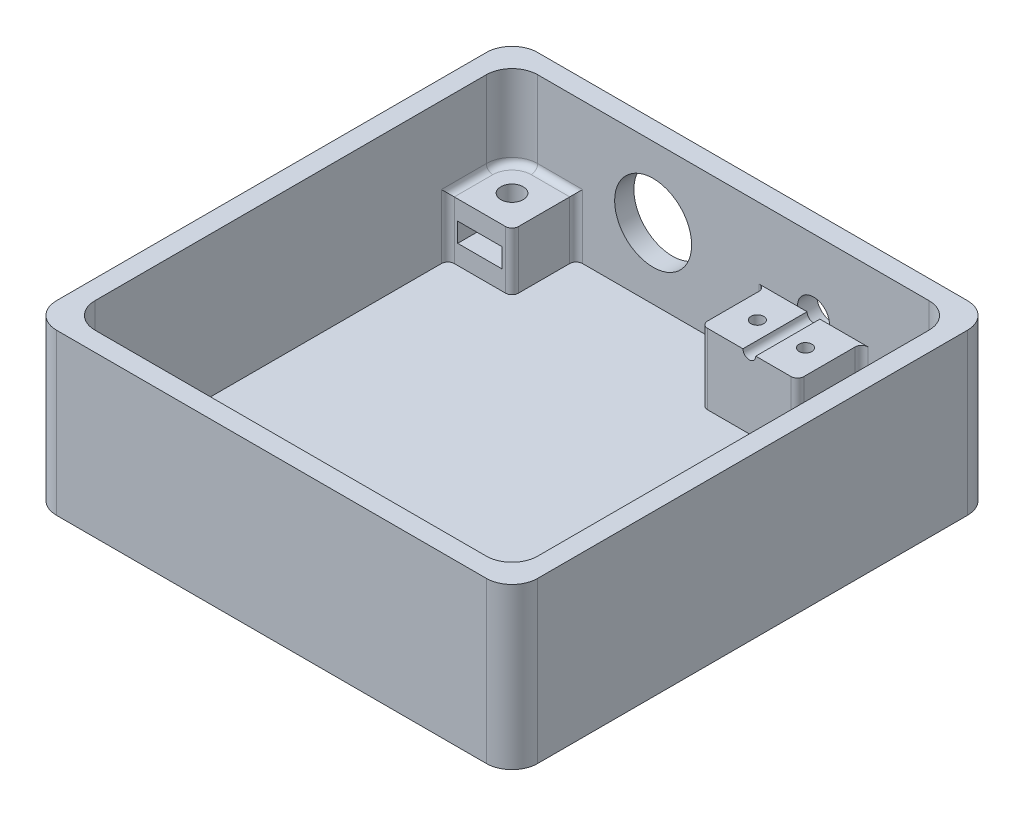
from build123d import *

# Parameters (mm, degrees)
SKETCH_1_W          = 75
SKETCH_1_H          = 75
EXTRUDE_1_DEPTH     = 25
SHELL_1_T           = -3
SKETCH_3_W          = 10
SKETCH_3_H          = 10
EXTRUDE_2_DEPTH     = 9
CUT_EXTRUDE_1_REACH = 56.603
SKETCH_4_R          = 1.75
CUT_EXTRUDE_START   = -3
CUT_EXTRUDE_2_DEPTH = 3
CUT_EXTRUDE_3_REACH = 89.5
SKETCH_6_R          = 6
SKETCH_6_R_2        = 2.5
EXTRUDE_3_DEPTH     = 10
SKETCH_8_R          = 1
CUT_EXTRUDE_4_DEPTH = 4
FILLET_1_R          = 4
FILLET_2_R          = 1


with BuildPart() as part:
    # 草图1 → 凸台-拉伸1 (new body)
    with BuildSketch(Plane(origin=(0, 0, 0), x_dir=(1, 0, 0), z_dir=(0, 1, 0))):
        Rectangle(SKETCH_1_W, SKETCH_1_H)
    extrude(amount=EXTRUDE_1_DEPTH)

    # 抽壳1
    shell_1_openings = [part.faces().sort_by_distance(p)[0] for p in [
        (0, 25, 0),
    ]]
    offset(amount=SHELL_1_T, openings=shell_1_openings, kind=Kind.INTERSECTION)

    # 草图3 → 凸台-拉伸2 (add)
    with BuildSketch(Plane(origin=(0, 3, 0), x_dir=(1, 0, 0), z_dir=(0, 1, 0))):
        with Locations((-29.5, -29.5)):
            Rectangle(SKETCH_3_W, SKETCH_3_H)
        with Locations((29.5, -29.5)):
            Rectangle(SKETCH_3_W, SKETCH_3_H)
        with Locations((29.5, 29.5)):
            Rectangle(SKETCH_3_W, SKETCH_3_H)
        with Locations((-29.5, 29.5)):
            Rectangle(SKETCH_3_W, SKETCH_3_H)
    extrude(amount=EXTRUDE_2_DEPTH)

    # 草图4 → 切除-拉伸1 (cut, up to next)
    with BuildSketch(Plane(origin=(0, 12, 0), x_dir=(1, 0, 0), z_dir=(0, 1, 0)), mode=Mode.PRIVATE) as cut_extrude_1_sk1:
        with Locations(Location((-29.5, 29.5, 0), (0, 0, 270))):
            Circle(SKETCH_4_R)
    cut_extrude_1_tool1 = extrude(cut_extrude_1_sk1.sketch, amount=-CUT_EXTRUDE_1_REACH, mode=Mode.PRIVATE) & part.part
    # 草图4 → 切除-拉伸1 (cut, up to next)
    with BuildSketch(Plane(origin=(0, 12, 0), x_dir=(1, 0, 0), z_dir=(0, 1, 0)), mode=Mode.PRIVATE) as cut_extrude_1_sk2:
        with Locations(Location((29.5, 29.5, 0), (0, 0, 270))):
            Circle(SKETCH_4_R)
    cut_extrude_1_tool2 = extrude(cut_extrude_1_sk2.sketch, amount=-CUT_EXTRUDE_1_REACH, mode=Mode.PRIVATE) & part.part
    # 草图4 → 切除-拉伸1 (cut, up to next)
    with BuildSketch(Plane(origin=(0, 12, 0), x_dir=(1, 0, 0), z_dir=(0, 1, 0)), mode=Mode.PRIVATE) as cut_extrude_1_sk3:
        with Locations(Location((29.5, -29.5, 0), (0, 0, 270))):
            Circle(SKETCH_4_R)
    cut_extrude_1_tool3 = extrude(cut_extrude_1_sk3.sketch, amount=-CUT_EXTRUDE_1_REACH, mode=Mode.PRIVATE) & part.part
    # 草图4 → 切除-拉伸1 (cut, up to next)
    with BuildSketch(Plane(origin=(0, 12, 0), x_dir=(1, 0, 0), z_dir=(0, 1, 0)), mode=Mode.PRIVATE) as cut_extrude_1_sk4:
        with Locations(Location((-29.5, -29.5, 0), (0, 0, 270))):
            Circle(SKETCH_4_R)
    cut_extrude_1_tool4 = extrude(cut_extrude_1_sk4.sketch, amount=-CUT_EXTRUDE_1_REACH, mode=Mode.PRIVATE) & part.part
    add(cut_extrude_1_tool1.solids().sort_by_distance((-29.5, 12, -29.5))[0], mode=Mode.SUBTRACT)
    add(cut_extrude_1_tool2.solids().sort_by_distance((29.5, 12, -29.5))[0], mode=Mode.SUBTRACT)
    add(cut_extrude_1_tool3.solids().sort_by_distance((29.5, 12, 29.5))[0], mode=Mode.SUBTRACT)
    add(cut_extrude_1_tool4.solids().sort_by_distance((-29.5, 12, 29.5))[0], mode=Mode.SUBTRACT)

    # 草图5 → 切除-拉伸2 (cut)
    with BuildSketch(Plane(origin=(0, 12, 0), x_dir=(1, 0, 0), z_dir=(0, 1, 0)).offset(CUT_EXTRUDE_START)):
        Polygon((-26.035898385, 29.5), (-27.767949192, 32.5), (-31.232050808, 32.5), (-32.964101615, 29.5), (-32.964101615, 24.5), (-26.035898385, 24.5), align=None)
        Polygon((32.964101615, 29.5), (31.232050808, 32.5), (27.767949192, 32.5), (26.035898385, 29.5), (26.035898385, 24.5), (32.964101615, 24.5), align=None)
        Polygon((26.035898385, -29.5), (27.767949192, -32.5), (31.232050808, -32.5), (32.964101615, -29.5), (32.964101615, -24.5), (26.035898385, -24.5), align=None)
        Polygon((-32.964101615, -29.5), (-31.232050808, -32.5), (-27.767949192, -32.5), (-26.035898385, -29.5), (-26.035898385, -24.5), (-32.964101615, -24.5), align=None)
    extrude(amount=-CUT_EXTRUDE_2_DEPTH, mode=Mode.SUBTRACT)

    # 草图6 → 切除-拉伸3 (cut, up to next)
    with BuildSketch(Plane(origin=(0, 0, -37.5), x_dir=(-1, 0, 0), z_dir=(0, 0, -1)), mode=Mode.PRIVATE) as cut_extrude_3_sk1:
        with Locations((12.5, 14)):
            Circle(SKETCH_6_R)
    cut_extrude_3_tool1 = extrude(cut_extrude_3_sk1.sketch, amount=-CUT_EXTRUDE_3_REACH, mode=Mode.PRIVATE) & part.part
    # 草图6 → 切除-拉伸3 (cut, up to next)
    with BuildSketch(Plane(origin=(0, 0, -37.5), x_dir=(-1, 0, 0), z_dir=(0, 0, -1)), mode=Mode.PRIVATE) as cut_extrude_3_sk2:
        with Locations((-12.5, 14)):
            Circle(SKETCH_6_R_2)
    cut_extrude_3_tool2 = extrude(cut_extrude_3_sk2.sketch, amount=-CUT_EXTRUDE_3_REACH, mode=Mode.PRIVATE) & part.part
    add(cut_extrude_3_tool1.solids().sort_by_distance((-12.5, 14, -37.5))[0], mode=Mode.SUBTRACT)
    add(cut_extrude_3_tool2.solids().sort_by_distance((12.5, 14, -37.5))[0], mode=Mode.SUBTRACT)

    # 草图7 → 凸台-拉伸3 (add)
    with BuildSketch(Plane.XY.offset(-34.5)):
        with BuildLine():
            Line((20, 0), (5, 0))
            Line((5, 0), (5, 14))
            Line((5, 14), (11.5, 14))
            ThreePointArc((11.5, 14), (12.5, 13), (13.5, 14))
            Line((13.5, 14), (20, 14))
            Line((20, 14), (20, 0))
        make_face()
    extrude(amount=EXTRUDE_3_DEPTH)

    # 草图8 → 切除-拉伸4 (cut)
    with BuildSketch(Plane(origin=(0, 14, 0), x_dir=(1, 0, 0), z_dir=(0, 1, 0))):
        with Locations(Location((16.25, 29.5, 0), (0, 0, 180))):
            Circle(SKETCH_8_R)
        with Locations(Location((8.75, 29.5, 0), (0, 0, 180))):
            Circle(SKETCH_8_R)
    extrude(amount=-CUT_EXTRUDE_4_DEPTH, mode=Mode.SUBTRACT)

    # 圆角1
    fillet_1_edges = [part.edges().sort_by_distance(p)[0] for p in [
        (34.5, 18.5, 34.5),
        (34.5, 18.5, -34.5),
        (-34.5, 18.5, -34.5),
        (-34.5, 18.5, 34.5),
        (37.5, 12.5, 37.5),
        (-37.5, 12.5, 37.5),
        (-37.5, 12.5, -37.5),
        (37.5, 12.5, -37.5),
    ]]
    fillet(fillet_1_edges, radius=FILLET_1_R)

    # 圆角2
    fillet_2_edges = [part.edges().sort_by_distance(p)[0] for p in [
        (20, 8.5, -34.5),
        (5, 8.5, -34.5),
        (5, 8.5, -24.5),
        (20, 8.5, -24.5),
        (-34.5, 12, -27.5),
        (-27.5, 12, 34.5),
        (-33.328427125, 12, 33.328427125),
        (27.5, 12, -34.5),
        (-33.328427125, 12, -33.328427125),
        (34.5, 12, 27.5),
        (33.328427125, 12, 33.328427125),
        (33.328427125, 12, -33.328427125),
        (-34.5, 7.5, -24.5),
        (-24.5, 7.5, -24.5),
        (-24.5, 7.5, -34.5),
        (-27.5, 12, -34.5),
        (-34.5, 7.5, 24.5),
        (-24.5, 7.5, 34.5),
        (-24.5, 7.5, 24.5),
        (-34.5, 12, 27.5),
        (34.5, 7.5, 24.5),
        (24.5, 7.5, 24.5),
        (24.5, 7.5, 34.5),
        (27.5, 12, 34.5),
        (34.5, 7.5, -24.5),
        (24.5, 7.5, -34.5),
        (24.5, 7.5, -24.5),
        (34.5, 12, -27.5),
    ]]
    fillet(fillet_2_edges, radius=FILLET_2_R)


solid = part.part
